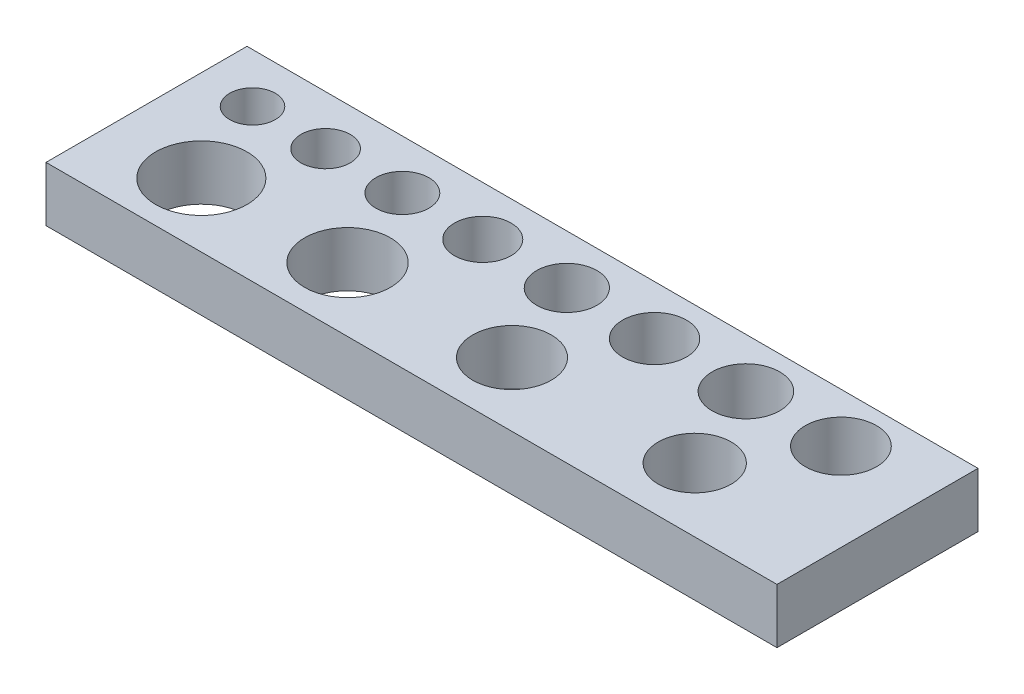
from build123d import *

# Parameters (mm, degrees)
SKETCH1_W           = 40
SKETCH1_H           = 11
BOSS_EXTRUDE1_DEPTH = 3
SKETCH2_R           = 1.25
SKETCH2_R_2         = 1.35
SKETCH2_R_3         = 1.45
SKETCH2_R_4         = 1.55
SKETCH2_R_5         = 1.65
SKETCH2_R_6         = 1.75
SKETCH2_R_7         = 1.85
SKETCH2_R_8         = 1.95
SKETCH2_R_9         = 2.15
SKETCH2_R_10        = 2
SKETCH2_R_11        = 2.5
SKETCH2_R_12        = 2.35
CUT_EXTRUDE1_DEPTH  = 21.958291915


with BuildPart() as part:
    # Sketch1 → Boss-Extrude1 (new body)
    with BuildSketch(Plane(origin=(0, 0, 0), x_dir=(1, 0, 0), z_dir=(0, 1, 0))):
        Rectangle(SKETCH1_W, SKETCH1_H)
    extrude(amount=BOSS_EXTRUDE1_DEPTH)

    # Sketch2 → Cut-Extrude1 (cut, through all)
    with BuildSketch(Plane(origin=(0, 3, 0), x_dir=(1, 0, 0), z_dir=(0, 1, 0))):
        with Locations(Location((-17, 2.8, 0), (0, 0, 270))):
            Circle(SKETCH2_R)
        with Locations(Location((-13, 2.8, 0), (0, 0, 270))):
            Circle(SKETCH2_R_2)
        with Locations(Location((-8.8, 2.8, 0), (0, 0, 270))):
            Circle(SKETCH2_R_3)
        with Locations(Location((-4.4, 2.8, 0), (0, 0, 270))):
            Circle(SKETCH2_R_4)
        with Locations(Location((0.2, 2.8, 0), (0, 0, 270))):
            Circle(SKETCH2_R_5)
        with Locations(Location((5, 2.8, 0), (0, 0, 270))):
            Circle(SKETCH2_R_6)
        with Locations(Location((10, 2.8, 0), (0, 0, 270))):
            Circle(SKETCH2_R_7)
        with Locations(Location((15.2, 2.8, 0), (0, 0, 270))):
            Circle(SKETCH2_R_8)
        with Locations(Location((2, -2, 0), (0, 0, 270))):
            Circle(SKETCH2_R_9)
        with Locations(Location((12, -2, 0), (0, 0, 270))):
            Circle(SKETCH2_R_10)
        with Locations(Location((-15, -2, 0), (0, 0, 270))):
            Circle(SKETCH2_R_11)
        with Locations(Location((-7, -2, 0), (0, 0, 270))):
            Circle(SKETCH2_R_12)
    extrude(amount=-CUT_EXTRUDE1_DEPTH, mode=Mode.SUBTRACT)


solid = part.part
